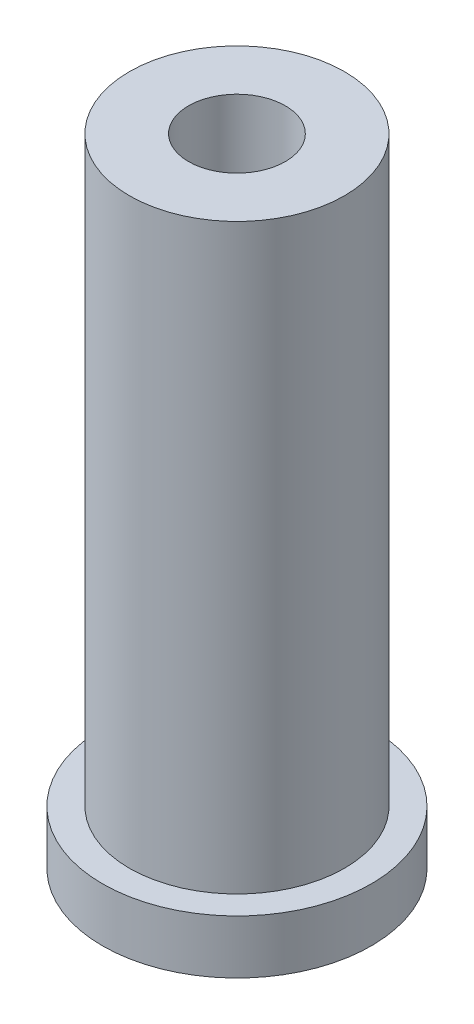
from build123d import *

# Parameters (mm, degrees)
SKETCH_1_R      = 7.5
SKETCH_1_R_2    = 2.7
EXTRUDE_1_DEPTH = 3
SKETCH_3_R      = 4
SKETCH_3_R_2    = 2.7
EXTRUDE_3_DEPTH = 32.5
EXTRUDE_START   = -32.5
SKETCH_4_R      = 6
SKETCH_4_R_2    = 2.7
EXTRUDE_4_DEPTH = 32.5


with BuildPart() as part:
    # 草圖1 → 填料-伸長1 (new body)
    with BuildSketch(Plane(origin=(0, 0, 0), x_dir=(1, 0, 0), z_dir=(0, 1, 0))):
        with Locations(Location((0, 0, 0), (0, 0, 270))):
            Circle(SKETCH_1_R)
        with Locations(Location((0, 0, 0), (0, 0, 270))):
            Circle(SKETCH_1_R_2, mode=Mode.SUBTRACT)
    extrude(amount=EXTRUDE_1_DEPTH)

    # 草圖3 → 填料-伸長3 (add)
    with BuildSketch(Plane(origin=(0, 3, 0), x_dir=(1, 0, 0), z_dir=(0, 1, 0))):
        with Locations(Location((0, 0, 0), (0, 0, 270))):
            Circle(SKETCH_3_R)
        with Locations(Location((0, 0, 0), (0, 0, 270))):
            Circle(SKETCH_3_R_2, mode=Mode.SUBTRACT)
    extrude(amount=EXTRUDE_3_DEPTH)

    # 草圖4 → 填料-伸長4 (add)
    with BuildSketch(Plane(origin=(0, 35.5, 0), x_dir=(1, 0, 0), z_dir=(0, 1, 0)).offset(EXTRUDE_START)):
        with Locations(Location((0, 0, 0), (0, 0, 270))):
            Circle(SKETCH_4_R)
        with Locations(Location((0, 0, 0), (0, 0, 270))):
            Circle(SKETCH_4_R_2, mode=Mode.SUBTRACT)
    extrude(amount=EXTRUDE_4_DEPTH)


solid = part.part
